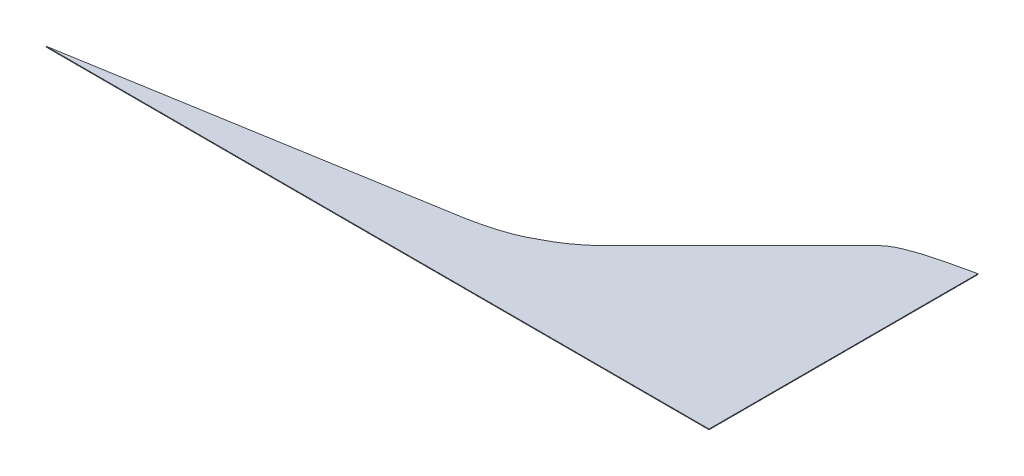
from build123d import *

# Parameters (mm, degrees)
BOSS_EXTRUDE2_DEPTH = 3.122929072
SCALE6_SCALE        = 8.1338973


with BuildPart() as part:
    # Sketch2 → Boss-Extrude2 (new body)
    with BuildSketch(Plane(origin=(0, 0, 0), x_dir=(1, 0, 0), z_dir=(0, 1, 0))):
        with BuildLine():
            Line((629.731048782, 277.215341973), (2214.379276625, 544.302389928))
            add(Edge.make_bspline(
                [(2214.379276625, 544.302389928), (2299.493055017, 561.920373013), (2384.440773399, 583.354771284), (2459.606558912, 628.974080467)],
                knots=[0, 0, 0, 0, 1, 1, 1, 1], degree=3))
            add(Edge.make_bspline(
                [(2459.606558912, 628.974080467), (2544.909830443, 672.429611603), (2615.909467864, 739.561267492)],
                knots=[0, 0, 0, 1, 1, 1], degree=2))
            Line((2615.909467864, 739.561267492), (3219.092035195, 1342.743834824))
            add(Edge.make_bspline(
                [(3219.092035195, 1342.743834824), (3249.792852386, 1375.667285093), (3294.123612778, 1392.505641268)],
                knots=[0, 0, 0, 1, 1, 1], degree=2))
            Line((3294.123612778, 1392.505641268), (3355.584917995, 1415.171147477))
            Line((3355.584917995, 1415.171147477), (3426.859238384, 1434.327823377))
            Line((3426.859238384, 1434.327823377), (3554.045415638, 1463.32634757))
            Line((3554.045415638, 1463.32634757), (3554.045415638, 277.215341973))
            Line((3554.045415638, 277.215341973), (629.731048782, 277.215341973))
        make_face()
    extrude(amount=-BOSS_EXTRUDE2_DEPTH)


with BuildPart() as part_1:
    # Scale6: scaled about (2809.926509229, -1.561464536, -651.665359315)
    add(part.part.scale(SCALE6_SCALE).moved(Location((-20045.727137387, 11.139327637, 4648.913747321))))


solid = part_1.part
